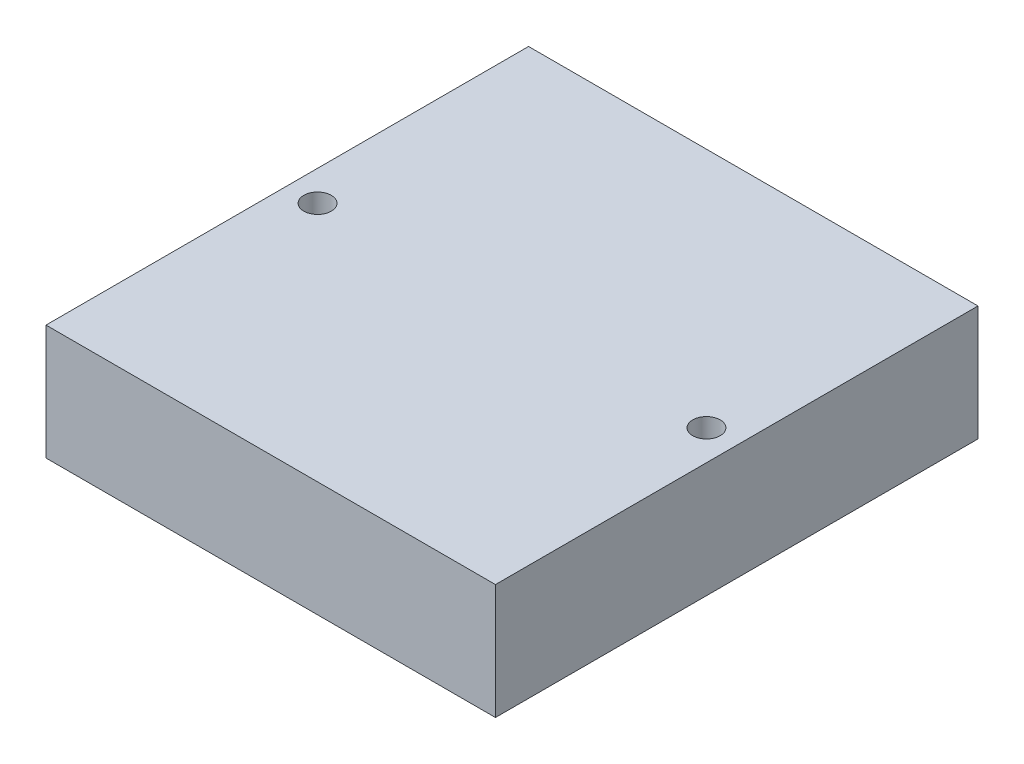
from build123d import *

# Parameters (mm, degrees)
SKETCH1_W           = 57.17
SKETCH1_H           = 61.38
SKETCH1_R           = 1.75
BOSS_EXTRUDE1_DEPTH = 14.65


with BuildPart() as part:
    # Sketch1 → Boss-Extrude1 (new body)
    with BuildSketch(Plane(origin=(0, 0, 0), x_dir=(1, 0, 0), z_dir=(0, 1, 0))):
        Rectangle(SKETCH1_W, SKETCH1_H)
        with Locations(Location((-24.735, 0, 0), (0, 0, 270))):
            Circle(SKETCH1_R, mode=Mode.SUBTRACT)
        with Locations(Location((24.735, 0, 0), (0, 0, 270))):
            Circle(SKETCH1_R, mode=Mode.SUBTRACT)
    extrude(amount=BOSS_EXTRUDE1_DEPTH)


solid = part.part
